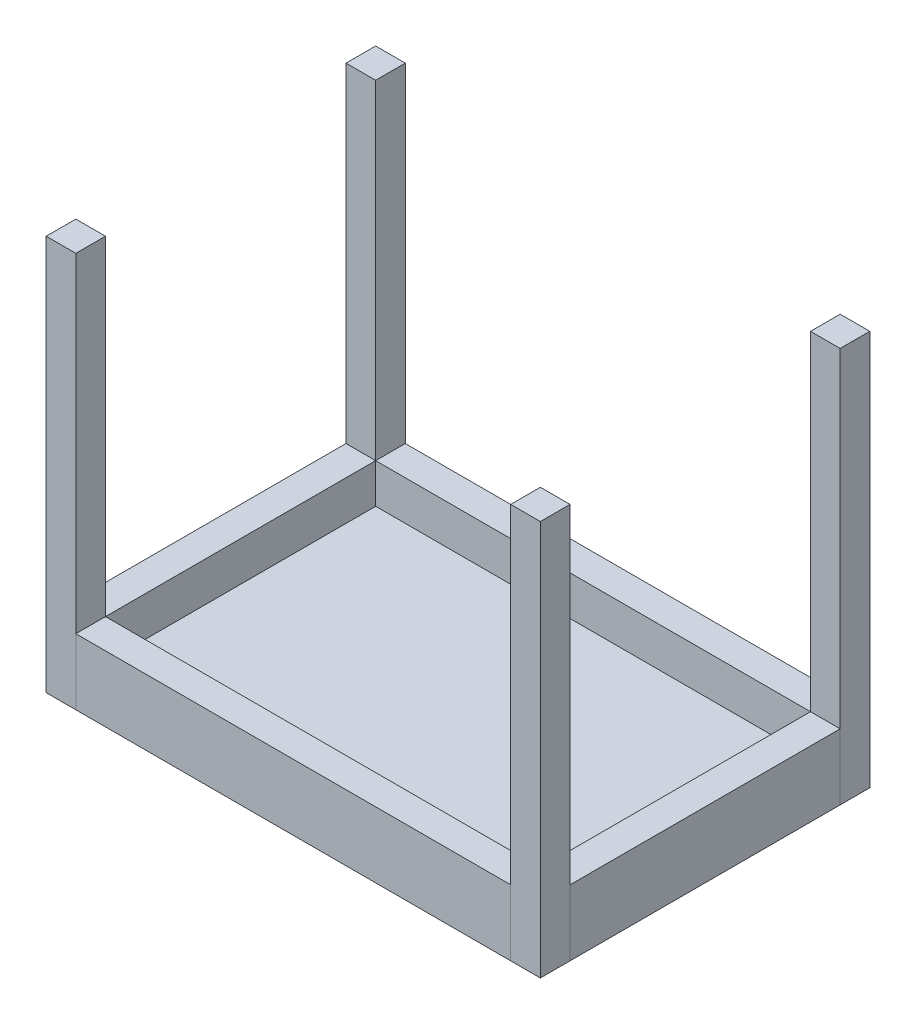
from build123d import *

# Parameters (mm, degrees)
SKETCH3_W              = 9
SKETCH3_H              = 20
BOSS_EXTRUDE2_DEPTH    = 82
SKETCH7_W              = 9
SKETCH7_H              = 20
BOSS_EXTRUDE7_DEPTH    = 132
SKETCH8_W              = 82
SKETCH8_H              = 20
BOSS_EXTRUDE8_DEPTH    = 9
SKETCH9_W              = 9
SKETCH9_H              = 20
BOSS_EXTRUDE9_DEPTH    = 132
BOSS_EXTRUDE13_REACH   = 173.905
SKETCH11_W             = 132
SKETCH11_H             = 8
SKETCH12_W             = 9
SKETCH12_H             = 9
BOSS_EXTRUDE14_DEPTH   = 120
BOSS_EXTRUDE14_2_DEPTH = 120
BOSS_EXTRUDE14_3_DEPTH = 120
BOSS_EXTRUDE14_4_DEPTH = 120


with BuildPart() as part:
    # Sketch3 → Boss-Extrude2 (new body)
    with BuildSketch(Plane.XY):
        Rectangle(SKETCH3_W, SKETCH3_H)
    extrude(amount=BOSS_EXTRUDE2_DEPTH)


with BuildPart() as body_2:
    # Sketch7 → Boss-Extrude7 (new body)
    with BuildSketch(Plane.ZY.offset(4.5)):
        with Locations((86.5, 0)):
            Rectangle(SKETCH7_W, SKETCH7_H)
    extrude(amount=BOSS_EXTRUDE7_DEPTH)


with BuildPart() as body_3:
    # Sketch8 → Boss-Extrude8 (new body)
    with BuildSketch(Plane.ZY.offset(136.5)):
        with Locations((41, 0)):
            Rectangle(SKETCH8_W, SKETCH8_H)
    extrude(amount=BOSS_EXTRUDE8_DEPTH)


with BuildPart() as body_4:
    # Sketch9 → Boss-Extrude9 (new body)
    with BuildSketch(Plane.ZY.offset(4.5)):
        with Locations((-4.5, 0)):
            Rectangle(SKETCH9_W, SKETCH9_H)
    extrude(amount=BOSS_EXTRUDE9_DEPTH)


with BuildPart() as body_5:

    # Sketch11 → Boss-Extrude13 (new, up to next)
    with BuildSketch(Plane(origin=(0, 0, 82), x_dir=(-1, 0, 0), z_dir=(0, 0, -1)), mode=Mode.PRIVATE) as boss_extrude13_sk1:
        with Locations((70.5, -6)):
            Rectangle(SKETCH11_W, SKETCH11_H)
    boss_extrude13_tool1 = extrude(boss_extrude13_sk1.sketch, amount=BOSS_EXTRUDE13_REACH, mode=Mode.PRIVATE) - body_4.part
    add(boss_extrude13_tool1.solids().sort_by_distance((-70.5, -6, 82))[0])


with BuildPart() as body_6:
    # Sketch12 → Boss-Extrude14 (new body)
    with BuildSketch(Plane.XZ.offset(10)):
        with Locations((-141, 86.5)):
            Rectangle(SKETCH12_W, SKETCH12_H)
    extrude(amount=-BOSS_EXTRUDE14_DEPTH)


with BuildPart() as body_7:
    # Sketch12 → Boss-Extrude14 2 (new body)
    with BuildSketch(Plane.XZ.offset(10)):
        with Locations((0, 86.5)):
            Rectangle(SKETCH12_W, SKETCH12_H)
    extrude(amount=-BOSS_EXTRUDE14_2_DEPTH)


with BuildPart() as body_8:
    # Sketch12 → Boss-Extrude14 3 (new body)
    with BuildSketch(Plane.XZ.offset(10)):
        with Locations((0, -4.5)):
            Rectangle(SKETCH12_W, SKETCH12_H)
    extrude(amount=-BOSS_EXTRUDE14_3_DEPTH)


with BuildPart() as body_9:
    # Sketch12 → Boss-Extrude14 4 (new body)
    with BuildSketch(Plane.XZ.offset(10)):
        with Locations((-141, -4.5)):
            Rectangle(SKETCH12_W, SKETCH12_H)
    extrude(amount=-BOSS_EXTRUDE14_4_DEPTH)


solid = Compound([part.part, body_2.part, body_3.part, body_4.part, body_5.part, body_6.part, body_7.part, body_8.part, body_9.part])
